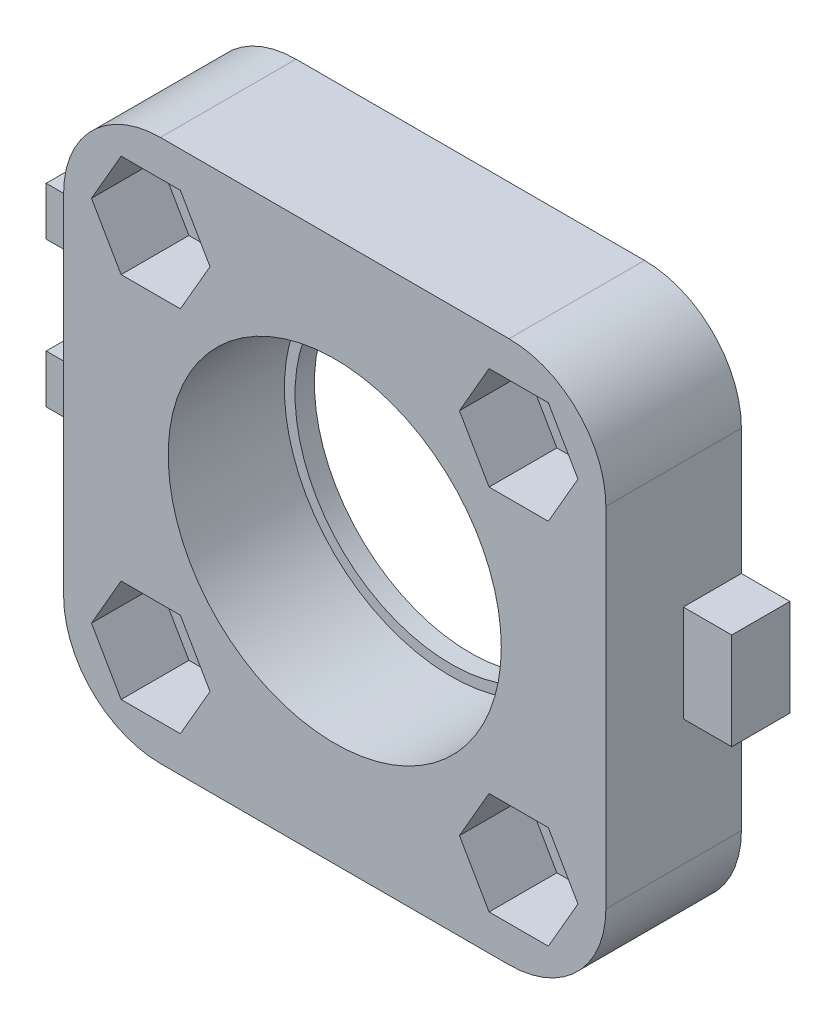
from build123d import *

# Parameters (mm, degrees)
CROQUIS1_W              = 28
CROQUIS1_H              = 28
CROQUIS1_R              = 8.05
SALIENTE_EXTRUIR1_DEPTH = 0.5
CROQUIS2_W              = 28
CROQUIS2_H              = 28
CROQUIS2_R              = 8.6
SALIENTE_EXTRUIR2_DEPTH = 6
CORTAR_EXTRUIR1_DEPTH   = 3.5
CROQUIS6_R              = 1.5
CORTAR_EXTRUIR2_DEPTH   = 23.5
CROQUIS7_W              = 2.5
CROQUIS7_H              = 5
CROQUIS7_W_2            = 10
CROQUIS7_H_2            = 3.5
SALIENTE_EXTRUIR3_DEPTH = 3
REDONDEO1_R             = 5


with BuildPart() as part:
    # Croquis1 → Saliente-Extruir1 (new, symmetric)
    with BuildSketch(Plane.XY):
        Rectangle(CROQUIS1_W, CROQUIS1_H)
        Circle(CROQUIS1_R, mode=Mode.SUBTRACT)
    extrude(amount=SALIENTE_EXTRUIR1_DEPTH, both=True)

    # Croquis2 → Saliente-Extruir2 (add)
    with BuildSketch(Plane.XY.offset(0.5)):
        Rectangle(CROQUIS2_W, CROQUIS2_H)
        Circle(CROQUIS2_R, mode=Mode.SUBTRACT)
    extrude(amount=SALIENTE_EXTRUIR2_DEPTH)

    # Croquis3 → Cortar-Extruir1 (cut)
    with BuildSketch(Plane.XY.offset(6.5)):
        Polygon((11.029978213, 12.15), (7.970021787, 12.15), (6.440043573, 9.5), (7.970021787, 6.85), (11.029978213, 6.85), (12.559956427, 9.5), align=None)
        Polygon((-6.440043573, 9.5), (-7.970021787, 12.15), (-11.029978213, 12.15), (-12.559956427, 9.5), (-11.029978213, 6.85), (-7.970021787, 6.85), align=None)
        Polygon((-7.970021787, -6.85), (-11.029978213, -6.85), (-12.559956427, -9.5), (-11.029978213, -12.15), (-7.970021787, -12.15), (-6.440043573, -9.5), align=None)
        Polygon((11.029978213, -6.85), (7.970021787, -6.85), (6.440043573, -9.5), (7.970021787, -12.15), (11.029978213, -12.15), (12.559956427, -9.5), align=None)
    extrude(amount=-CORTAR_EXTRUIR1_DEPTH, mode=Mode.SUBTRACT)

    # Croquis6 → Cortar-Extruir2 (cut)
    with BuildSketch(Plane(origin=(0, 0, -0.5), x_dir=(-1, 0, 0), z_dir=(0, 0, -1))):
        with Locations((-9.5, 9.5)):
            Circle(CROQUIS6_R)
        with Locations((9.5, 9.5)):
            Circle(CROQUIS6_R)
        with Locations((9.5, -9.5)):
            Circle(CROQUIS6_R)
        with Locations((-9.5, -9.5)):
            Circle(CROQUIS6_R)
    extrude(amount=-CORTAR_EXTRUIR2_DEPTH, mode=Mode.SUBTRACT)

    # Croquis7 → Saliente-Extruir3 (add)
    with BuildSketch(Plane(origin=(0, 0, -0.5), x_dir=(-1, 0, 0), z_dir=(0, 0, -1))):
        with Locations((-15.25, 0)):
            Rectangle(CROQUIS7_W, CROQUIS7_H)
        with Locations((0, -15.75)):
            Rectangle(CROQUIS7_W_2, CROQUIS7_H_2)
        Polygon((14, -2.5), (14, -5), (18.9, -5), (18.9, -2.5), (16.5, -2.5), align=None)
        with Locations((15.25, 0)):
            Rectangle(CROQUIS7_W, CROQUIS7_H)
        Polygon((14, 5), (14, 2.5), (16.5, 2.5), (18.9, 2.5), (18.9, 5), align=None)
    extrude(amount=-SALIENTE_EXTRUIR3_DEPTH)

    # Redondeo1
    redondeo1_edges = [part.edges().sort_by_distance(p)[0] for p in [
        (14, -14, 3),
        (-14, -14, 3),
        (-14, 14, 3),
        (14, 14, 3),
    ]]
    fillet(redondeo1_edges, radius=REDONDEO1_R)


solid = part.part
